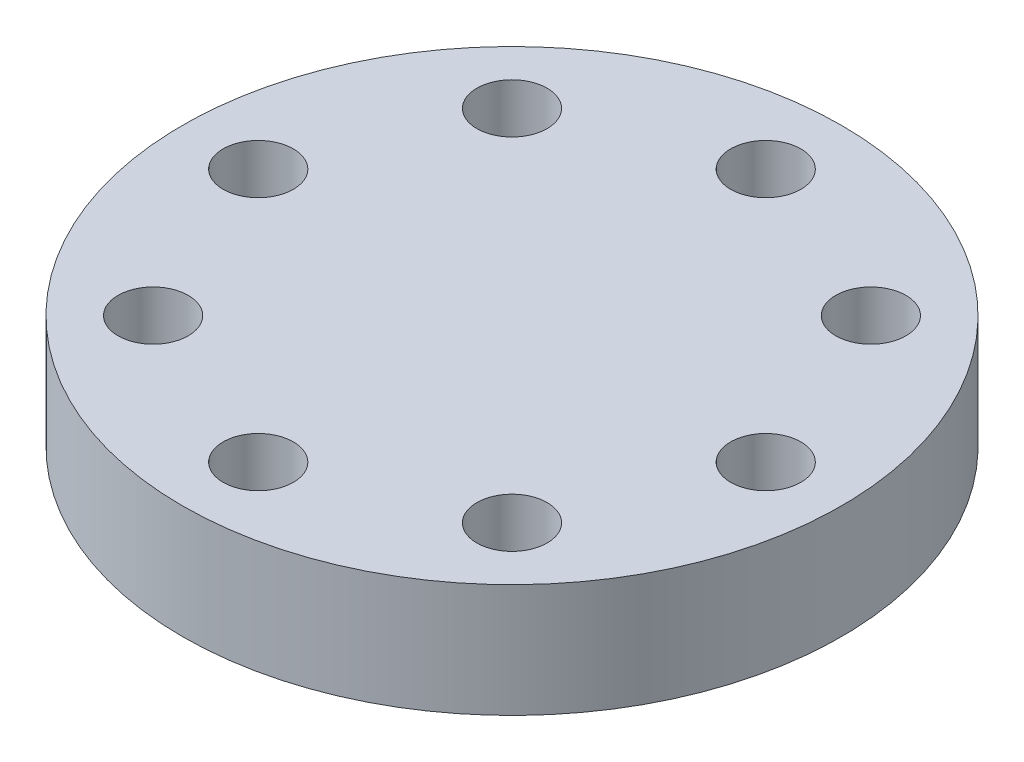
from build123d import *

# Parameters (mm, degrees)
SKETCH1_R                 = 12.7
BOSS_EXTRUDE1_DEPTH       = 4.365625
F_6_32_TAPPED_HOLE1_D     = 2.7051
F_6_32_TAPPED_HOLE1_DEPTH = 23.876
F_6_32_TAPPED_HOLE1_TIP   = 0.81269403


with BuildPart() as part:
    # Sketch1 → Boss-Extrude1 (new body)
    with BuildSketch(Plane(origin=(0, 0, 0), x_dir=(1, 0, 0), z_dir=(0, 1, 0))):
        with Locations(Location((0, 0, 0), (0, 0, 270))):
            Circle(SKETCH1_R)
    extrude(amount=BOSS_EXTRUDE1_DEPTH)

    # #6-32 Tapped Hole1
    with Locations(Plane(origin=(0, 4.365625, 0), x_dir=(1, 0, 0), z_dir=(0, 1, 0))):
        with Locations((0, 9.779), (6.914797213, 6.914797213), (9.779, 0), (6.914797213, -6.914797213), (0, -9.779), (-6.914797213, -6.914797213), (-9.779, 0), (-6.914797213, 6.914797213)):
            Hole(F_6_32_TAPPED_HOLE1_D / 2, depth=F_6_32_TAPPED_HOLE1_DEPTH)
            with Locations((0, 0, -(F_6_32_TAPPED_HOLE1_DEPTH + F_6_32_TAPPED_HOLE1_TIP / 2))):  # 118° drill point
                Cone(0, F_6_32_TAPPED_HOLE1_D / 2, F_6_32_TAPPED_HOLE1_TIP, mode=Mode.SUBTRACT)


solid = part.part
